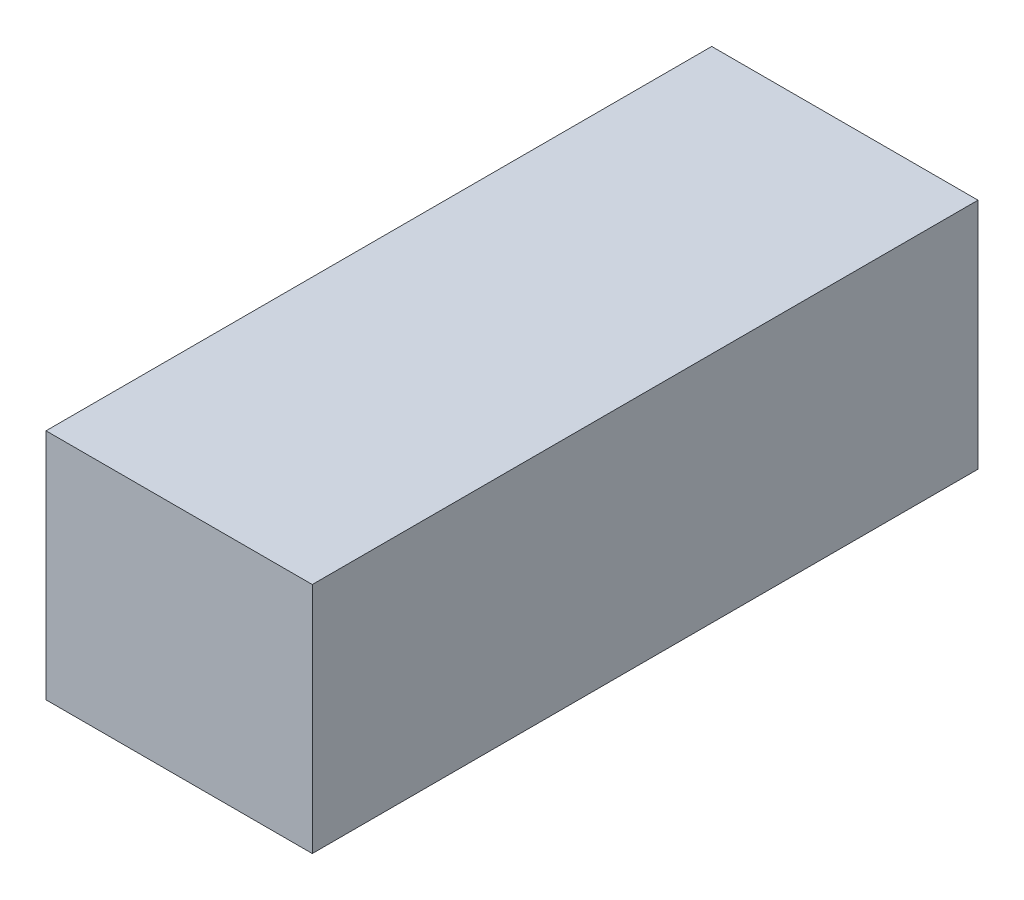
from build123d import *

# Parameters (mm, degrees)
SKETCH1_W           = 4
SKETCH1_H           = 3.5
BOSS_EXTRUDE1_DEPTH = 10


with BuildPart() as part:
    # Sketch1 → Boss-Extrude1 (new body)
    with BuildSketch(Plane.XY):
        Rectangle(SKETCH1_W, SKETCH1_H)
    extrude(amount=BOSS_EXTRUDE1_DEPTH)


solid = part.part
